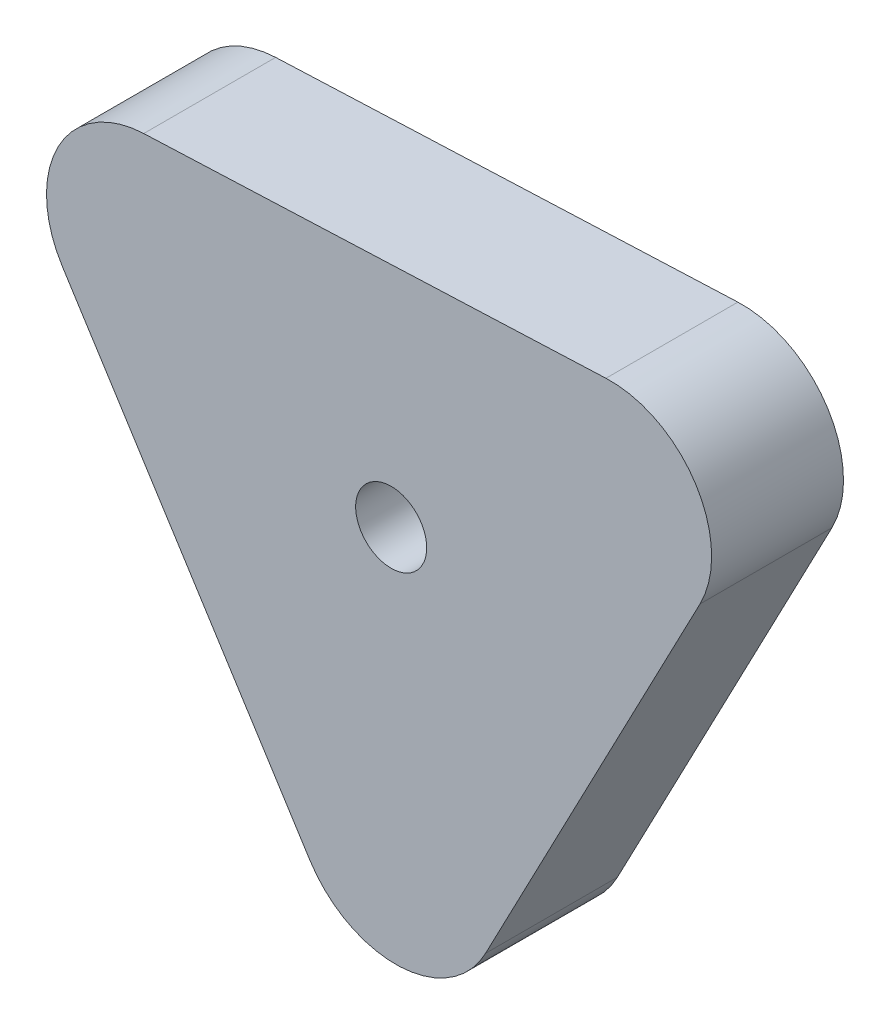
from build123d import *

# Parameters (mm, degrees)
EXTRUDE_2_DEPTH     = 13
SKETCH_5_R          = 3.5
CUT_EXTRUDE_3_DEPTH = 13


with BuildPart() as part:
    # 草图1 → 凸台-拉伸2 (new body)
    with BuildSketch(Plane.XY):
        with BuildLine():
            Line((8.355798715, -13.336367576), (29.501926433, 27.06708322))
            ThreePointArc((29.501926433, 27.06708322), (29.0877743, 37.05850344), (20.227874503, 41.695547281))
            Line((20.227874503, 41.695547281), (-25.335604147, 39.806905679))
            ThreePointArc((-25.335604147, 39.806905679), (-33.78135181, 34.452529301), (-33.367199677, 24.461109081))
            Line((-33.367199677, 24.461109081), (-8.949848746, -14.053700113))
            ThreePointArc((-8.949848746, -14.053700113), (-0.089948949, -18.690743955), (8.355798715, -13.336367576))
        make_face()
    extrude(amount=EXTRUDE_2_DEPTH)

    # 草图5 → 切除-拉伸3 (cut)
    with BuildSketch(Plane.XY.offset(13)):
        with Locations((-0.945044174, 18.385896346)):
            Circle(SKETCH_5_R)
    extrude(amount=-CUT_EXTRUDE_3_DEPTH, mode=Mode.SUBTRACT)


solid = part.part
